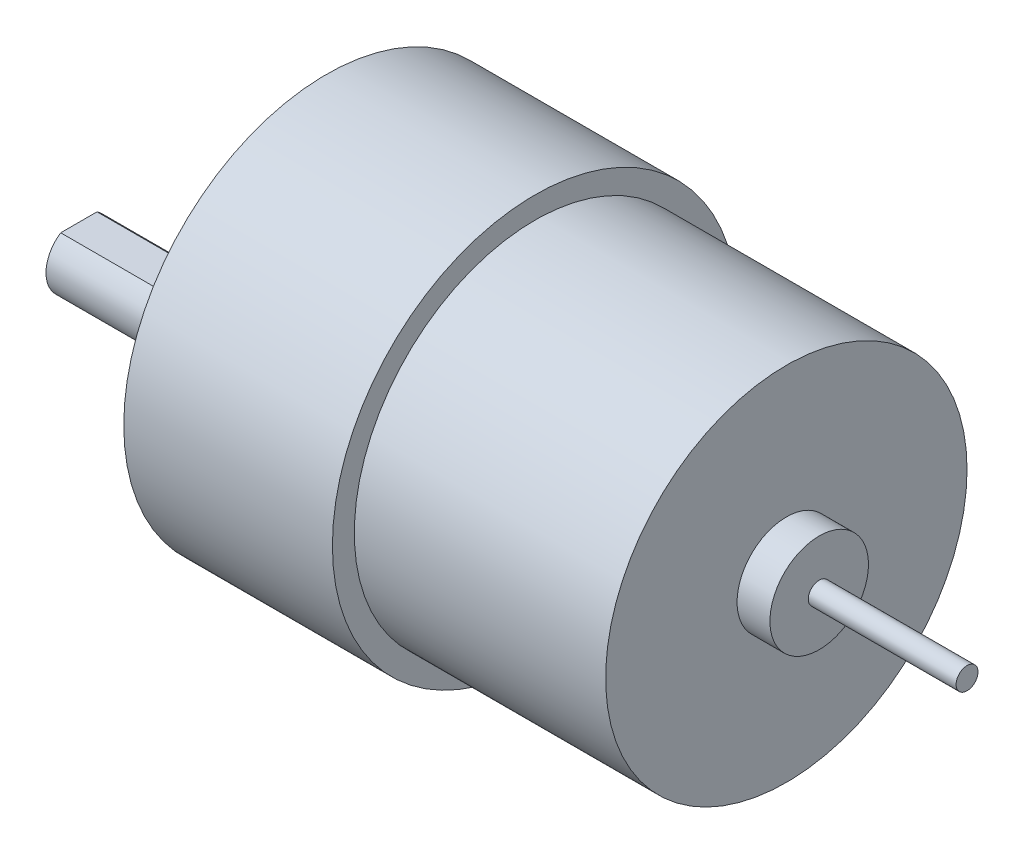
from build123d import *

# Parameters (mm, degrees)
SKETCH1_R           = 18.5
BOSS_EXTRUDE1_DEPTH = 19.05
SKETCH2_R           = 16.5
BOSS_EXTRUDE2_DEPTH = 22.95
SKETCH3_R           = 4.5
BOSS_EXTRUDE3_DEPTH = 3
SKETCH4_R           = 1
BOSS_EXTRUDE4_DEPTH = 13.5
SKETCH5_R           = 6
BOSS_EXTRUDE5_DEPTH = 4.6
SKETCH7_R           = 3
BOSS_EXTRUDE6_DEPTH = 6
BOSS_EXTRUDE7_DEPTH = 12


with BuildPart() as part:
    # Sketch1 → Boss-Extrude1 (new body)
    with BuildSketch(Plane(origin=(0, 0, 0), x_dir=(0, 0, -1), z_dir=(1, 0, 0))):
        with Locations(Location((0, 0, 0), (0, 0, 180))):
            Circle(SKETCH1_R)
    extrude(amount=BOSS_EXTRUDE1_DEPTH)

    # Sketch2 → Boss-Extrude2 (add)
    with BuildSketch(Plane(origin=(19.05, 0, 0), x_dir=(0, 0, -1), z_dir=(1, 0, 0))):
        Circle(SKETCH2_R)
    extrude(amount=BOSS_EXTRUDE2_DEPTH)

    # Sketch3 → Boss-Extrude3 (add)
    with BuildSketch(Plane(origin=(42, 0, 0), x_dir=(0, 0, -1), z_dir=(1, 0, 0))):
        Circle(SKETCH3_R)
    extrude(amount=BOSS_EXTRUDE3_DEPTH)

    # Sketch4 → Boss-Extrude4 (add)
    with BuildSketch(Plane(origin=(45, 0, 0), x_dir=(0, 0, -1), z_dir=(1, 0, 0))):
        Circle(SKETCH4_R)
    extrude(amount=BOSS_EXTRUDE4_DEPTH)

    # Sketch5 → Boss-Extrude5 (add)
    with BuildSketch(Plane.ZY):
        with Locations(Location((0, -7, 0), (0, 0, 180))):
            Circle(SKETCH5_R)
    extrude(amount=BOSS_EXTRUDE5_DEPTH)

    # Sketch7 → Boss-Extrude6 (add)
    with BuildSketch(Plane.ZY.offset(4.6)):
        with Locations((0, -7)):
            Circle(SKETCH7_R)
    extrude(amount=BOSS_EXTRUDE6_DEPTH)

    # Sketch8 → Boss-Extrude7 (add)
    with BuildSketch(Plane.ZY.offset(10.6)):
        with BuildLine():
            Line((-1.658312395, -4.5), (1.658312395, -4.5))
            ThreePointArc((1.658312395, -4.5), (0, -10), (-1.658312395, -4.5))
        make_face()
    extrude(amount=BOSS_EXTRUDE7_DEPTH)


solid = part.part
